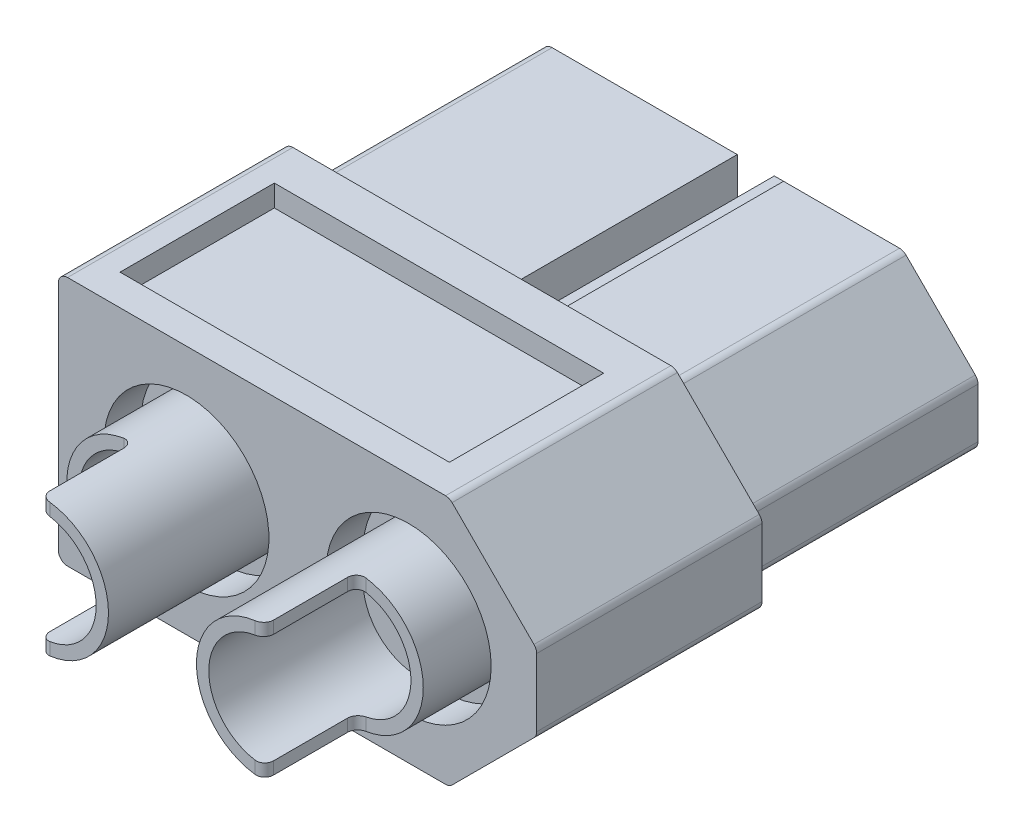
from build123d import *

# Parameters (mm, degrees)
EXTRUDE_1_DEPTH                  = 15
CUT_EXTRUDE_1_DEPTH              = 7.7
SKETCH_13_R                      = 2.175
CUT_EXTRUDE_9_DEPTH              = 7.7
CUT_EXTRUDE_10_REACH             = 18.085
SKETCH_3_W                       = 1.5
SKETCH_3_H                       = 1.2
CUT_EXTRUDE_10_DIRECTION_2_REACH = 18.085
SKETCH_14_W                      = 1.5
SKETCH_14_H                      = 4
EXTRUDE_5_DEPTH                  = 1.2
EXTRUDE_3_DEPTH                  = 6.5
EXTRUDE_3_DEPTH_BACK             = 12
SKETCH_5_R                       = 2.175
CUT_EXTRUDE_START                = -1.2
SKETCH_6_R                       = 2.675
SKETCH_6_R_2                     = 2.175
CUT_EXTRUDE_3_DEPTH              = 1.2
SKETCH_7_R                       = 1.775
CUT_EXTRUDE_4_DEPTH              = 5
CUT_EXTRUDE_5_DEPTH              = 22.553537993
CUT_EXTRUDE_5_DEPTH_BACK         = 22.553537993
SKETCH_8_W                       = 2.15
SKETCH_8_H                       = 3
SKETCH_10_R                      = 2.15
CUT_EXTRUDE_7_DEPTH              = 6.5
FILLET_2_R                       = 0.3
SKETCH_11_W                      = 10.671572875
SKETCH_11_H                      = 5
CUT_EXTRUDE_8_DEPTH              = 0.7
SKETCH_12_W                      = 0.743589744
SKETCH_12_H                      = 0.230769231
EXTRUDE_4_DEPTH                  = 0.2
FILLET_3_R                       = 0.3


with BuildPart() as part:
    # Эскиз1 → Бобышка-Вытянуть1 (new body)
    with BuildSketch(Plane.XY):
        Polygon((7.75, 1.221572875), (4.921572875, 4.05), (-7.75, 4.05), (-7.75, -4.05), (4.921572875, -4.05), (7.75, -1.221572875), align=None)
    extrude(amount=EXTRUDE_1_DEPTH)

    # Эскиз2 → Вырез-Вытянуть1 (cut)
    with BuildSketch(Plane(origin=(0, 0, 0), x_dir=(-1, 0, 0), z_dir=(0, 0, -1))):
        Polygon((-7.75, -1.221572875), (-4.921572875, -4.05), (7.75, -4.05), (7.75, 4.05), (-4.921572875, 4.05), (-7.75, 1.221572875), align=None)
        Polygon((-7.05, -0.931623382), (-4.631623382, -3.35), (7.05, -3.35), (7.05, 3.35), (-4.631623382, 3.35), (-7.05, 0.931623382), align=None, mode=Mode.SUBTRACT)
    extrude(amount=-CUT_EXTRUDE_1_DEPTH, mode=Mode.SUBTRACT)

    # Эскиз13 → Вырез-Вытянуть9 (cut)
    with BuildSketch(Plane(origin=(0, 0, 0), x_dir=(-1, 0, 0), z_dir=(0, 0, -1))):
        with Locations((-3.6, 0)):
            Circle(SKETCH_13_R)
        with Locations((3.6, 0)):
            Circle(SKETCH_13_R)
    extrude(amount=-CUT_EXTRUDE_9_DEPTH, mode=Mode.SUBTRACT)

    # Вырез-Вытянуть10: up to this face of the body (flat: up to its plane)
    cut_extrude_10_end = Plane(part.part.faces().sort_by_distance((3.6, 0, 7.7))[0])
    # Эскиз3 → Вырез-Вытянуть10 (cut, up to the picked face)
    with BuildSketch(Plane(origin=(0, 0, 1.5), x_dir=(-1, 0, 0), z_dir=(0, 0, -1)), mode=Mode.PRIVATE) as cut_extrude_10_sk1:
        with Locations((0, 2.75)):
            Rectangle(SKETCH_3_W, SKETCH_3_H)
    cut_extrude_10_tool1 = split(extrude(cut_extrude_10_sk1.sketch, amount=-CUT_EXTRUDE_10_REACH, mode=Mode.PRIVATE), bisect_by=cut_extrude_10_end, keep=Keep.BOTH, mode=Mode.PRIVATE)
    add(cut_extrude_10_tool1.solids().sort_by(Axis((0, 2.75, 1.5), (0, 0, 1)))[0], mode=Mode.SUBTRACT)

    # Вырез-Вытянуть10 direction 2: up to this face of the body (flat: up to its plane)
    cut_extrude_10_direction_2_end = Plane(part.part.faces().sort_by_distance((-0.620013342, 0, 0))[0])
    # Эскиз3 → Вырез-Вытянуть10 direction 2 (cut, up to the picked face)
    with BuildSketch(Plane(origin=(0, 0, 1.5), x_dir=(-1, 0, 0), z_dir=(0, 0, -1)), mode=Mode.PRIVATE) as cut_extrude_10_direction_2_sk1:
        with Locations((0, 2.75)):
            Rectangle(SKETCH_3_W, SKETCH_3_H)
    cut_extrude_10_direction_2_tool1 = split(extrude(cut_extrude_10_direction_2_sk1.sketch, amount=CUT_EXTRUDE_10_DIRECTION_2_REACH, mode=Mode.PRIVATE), bisect_by=cut_extrude_10_direction_2_end, keep=Keep.BOTH, mode=Mode.PRIVATE)
    add(cut_extrude_10_direction_2_tool1.solids().sort_by(Axis((0, 2.75, 1.5), (0, 0, -1)))[0], mode=Mode.SUBTRACT)

    # Эскиз14 → Бобышка-Вытянуть5 (add)
    with BuildSketch(Plane(origin=(0, 0, 0), x_dir=(-1, 0, 0), z_dir=(0, 0, -1))):
        with Locations((0, 0.15)):
            Rectangle(SKETCH_14_W, SKETCH_14_H)
    extrude(amount=EXTRUDE_5_DEPTH)

    # Эскиз5 → Бобышка-Вытянуть3 (add, two sides: drawn at the far end of the back side and taken through both)
    with BuildSketch(Plane(origin=(0, 0, 7.7), x_dir=(-1, 0, 0), z_dir=(0, 0, -1)).offset(-EXTRUDE_3_DEPTH_BACK)):
        with Locations((3.6, 0)):
            Circle(SKETCH_5_R)
        with Locations((-3.6, 0)):
            Circle(SKETCH_5_R)
    extrude(amount=EXTRUDE_3_DEPTH + EXTRUDE_3_DEPTH_BACK)

    # Эскиз6 → Вырез-Вытянуть3 (cut)
    # profile 1 of 2: a face of its own
    with BuildSketch(Plane.XY.offset(15).offset(CUT_EXTRUDE_START)):
        with Locations((3.6, 0)):
            Circle(SKETCH_6_R)
        with Locations(Location((3.6, 0, 0), (0, 0, 180))):
            Circle(SKETCH_6_R_2, mode=Mode.SUBTRACT)
    # profile 2 of 2: a face of its own
    with BuildSketch(Plane.XY.offset(15).offset(CUT_EXTRUDE_START)):
        with Locations(Location((-3.6, 0, 0), (0, 0, 180))):
            Circle(SKETCH_6_R)
        with Locations(Location((-3.6, 0, 0), (0, 0, 180))):
            Circle(SKETCH_6_R_2, mode=Mode.SUBTRACT)
    extrude(amount=CUT_EXTRUDE_3_DEPTH, mode=Mode.SUBTRACT)

    # Эскиз7 → Вырез-Вытянуть4 (cut)
    with BuildSketch(Plane.XY.offset(19.7)):
        with Locations((-3.6, 0)):
            Circle(SKETCH_7_R)
        with Locations(Location((3.6, 0, 0), (0, 0, 180))):
            Circle(SKETCH_7_R)
    extrude(amount=-CUT_EXTRUDE_4_DEPTH, mode=Mode.SUBTRACT)

    # Эскиз8 → Вырез-Вытянуть5 (cut, two sides: drawn at the far end of the back side and taken through both)
    with BuildSketch(Plane(origin=(0, 0, 0), x_dir=(1, 0, 0), z_dir=(0, 1, 0)).offset(-CUT_EXTRUDE_5_DEPTH_BACK)):
        with Locations((4.7, -18.2)):
            Rectangle(SKETCH_8_W, SKETCH_8_H)
        with Locations((-4.7, -18.2)):
            Rectangle(SKETCH_8_W, SKETCH_8_H)
    extrude(amount=CUT_EXTRUDE_5_DEPTH + CUT_EXTRUDE_5_DEPTH_BACK, mode=Mode.SUBTRACT)

    # Эскиз10 → Вырез-Вытянуть7 (cut)
    with BuildSketch(Plane(origin=(0, 0, 1.2), x_dir=(-1, 0, 0), z_dir=(0, 0, -1))):
        with Locations((-3.6, 0)):
            Circle(SKETCH_10_R)
        with Locations((3.6, 0)):
            Circle(SKETCH_10_R)
    extrude(amount=-CUT_EXTRUDE_7_DEPTH, mode=Mode.SUBTRACT)

    # Скругление2
    fillet_2_edges = [part.edges().sort_by_distance(p)[0] for p in [
        (-3.625, 1.974840126, 16.7),
        (-3.625, -1.974840126, 16.7),
        (-3.625, 1.974840126, 19.7),
        (-3.625, -1.974840126, 19.7),
        (3.625, -1.974840126, 19.7),
        (3.625, 1.974840126, 19.7),
        (3.625, 1.974840126, 16.7),
        (3.625, -1.974840126, 16.7),
    ]]
    fillet(fillet_2_edges, radius=FILLET_2_R)

    # Эскиз11 → Вырез-Вытянуть8 (cut)
    with BuildSketch(Plane(origin=(0, 4.05, 0), x_dir=(1, 0, 0), z_dir=(0, 1, 0))):
        with Locations((-1.414213562, -11.5)):
            Rectangle(SKETCH_11_W, SKETCH_11_H)
    cut_extrude_8 = extrude(amount=-CUT_EXTRUDE_8_DEPTH, mode=Mode.SUBTRACT)

    # Зеркальное отражение1: Вырез-Вытянуть8 across plane
    add(cut_extrude_8.mirror(Plane.ZX), mode=Mode.SUBTRACT)

    # Эскиз12 → Бобышка-Вытянуть4 (add)
    # profile 1 of 5: a face of its own
    with BuildSketch(Plane.XZ.offset(3.35)):
        with BuildLine():
            Line((2.409553644, 12.5), (1.670370952, 11.423878205))
            Line((1.670370952, 11.423878205), (2.306989542, 10.5))
            Line((2.306989542, 10.5), (1.967245952, 10.5))
            Line((1.967245952, 10.5), (1.618287619, 11.006410256))
            add(Edge.make_bspline(
                [(1.618287619, 11.006410256), (1.609716279, 11.019080657), (1.593631875, 11.042857083), (1.57132612, 11.076612212), (1.552930289, 11.106570753), (1.538116623, 11.132498509), (1.52669851, 11.154212753), (1.518724987, 11.171824354), (1.514563909, 11.185833759), (1.514533668, 11.193896175), (1.514521593, 11.197115385)],
                knots=[0, 0, 0, 0, 1.676374632, 3.145772549, 4.433387901, 5.527971266, 6.418173079, 7.119576872, 7.648459376, 8, 8, 8, 8], degree=3))
            add(Edge.make_bspline(
                [(1.514521593, 11.197115385), (1.505939018, 11.184719792), (1.487172134, 11.157615267), (1.45748844, 11.112979609), (1.42192354, 11.062359172), (1.397091731, 11.026070545), (1.383912619, 11.006810897)],
                knots=[0, 0, 0, 0, 0.783829651, 1.713942406, 2.786709065, 4, 4, 4, 4], degree=3))
            Line((1.383912619, 11.006810897), (1.036156209, 10.5))
            Line((1.036156209, 10.5), (0.691604927, 10.5))
            Line((0.691604927, 10.5), (1.328223516, 11.427083333))
            Line((1.328223516, 11.427083333), (0.589040824, 12.5))
            Line((0.589040824, 12.5), (0.929185055, 12.5))
            Line((0.929185055, 12.5), (1.415963901, 11.793269231))
            add(Edge.make_bspline(
                [(1.415963901, 11.793269231), (1.429874296, 11.773252023), (1.457377052, 11.733675264), (1.484627598, 11.693924429), (1.498095311, 11.674278846)],
                knots=[0, 0, 0, 0, 1.011563749, 2, 2, 2, 2], degree=3))
            add(Edge.make_bspline(
                [(1.498095311, 11.674278846), (1.508350537, 11.689255237), (1.527228888, 11.716824555), (1.55350676, 11.754365325), (1.574243279, 11.785462974), (1.58675493, 11.803696514), (1.592245952, 11.811698718)],
                knots=[0, 0, 0, 0, 1.307556106, 2.407017115, 3.300883259, 4, 4, 4, 4], degree=3))
            Line((1.592245952, 11.811698718), (2.065403003, 12.5))
            Line((2.065403003, 12.5), (2.409553644, 12.5))
        make_face()
    # profile 2 of 5: a face of its own
    with BuildSketch(Plane.XZ.offset(3.35)):
        Polygon((-0.142529689, 12.5), (-0.142529689, 10.730769231), (0.498495952, 10.730769231), (0.498495952, 10.5), (-1.065606612, 10.5), (-1.065606612, 10.730769231), (-0.424580971, 10.730769231), (-0.424580971, 12.5), align=None)
    # profile 3 of 5: a face of its own
    with BuildSketch(Plane.XZ.offset(3.35)):
        with Locations((-1.565606612, 11.794871795)):
            Rectangle(SKETCH_12_W, SKETCH_12_H)
    # profile 4 of 5: a face of its own
    with BuildSketch(Plane.XZ.offset(3.35)):
        with BuildLine():
            Line((-3.424580971, 11.012820513), (-3.168170714, 11.038461538))
            add(Edge.make_bspline(
                [(-3.168170714, 11.038461538), (-3.162637587, 11.016408888), (-3.152222327, 10.974898169), (-3.130381624, 10.91859514), (-3.106313636, 10.870972353), (-3.085403784, 10.845328798), (-3.075622638, 10.833333333)],
                knots=[0, 0, 0, 0, 1.199207122, 2.257322842, 3.184815751, 4, 4, 4, 4], degree=3))
            add(Edge.make_bspline(
                [(-3.075622638, 10.833333333), (-3.067226661, 10.825151768), (-3.050713717, 10.809060522), (-3.023605475, 10.788085468), (-2.9950289, 10.770314351), (-2.964897623, 10.755917051), (-2.933374427, 10.744544011), (-2.900328735, 10.736587964), (-2.865835411, 10.731662719), (-2.842332519, 10.731069596), (-2.83043033, 10.730769231)],
                knots=[0, 0, 0, 0, 1.028360939, 2.022547923, 3.001693811, 3.976902288, 4.948369586, 5.937776631, 6.955661634, 8, 8, 8, 8], degree=3))
            add(Edge.make_bspline(
                [(-2.83043033, 10.730769231), (-2.811134834, 10.731390522), (-2.773007776, 10.732618166), (-2.717068568, 10.744636707), (-2.662735872, 10.762624371), (-2.629074759, 10.780858577), (-2.612080971, 10.790064103)],
                knots=[0, 0, 0, 0, 1.010336883, 1.996381556, 2.988474728, 4, 4, 4, 4], degree=3))
            add(Edge.make_bspline(
                [(-2.612080971, 10.790064103), (-2.59537236, 10.803912925), (-2.56107358, 10.832341244), (-2.516363185, 10.88468468), (-2.476649304, 10.945809013), (-2.446911914, 11.002745022), (-2.426541131, 11.054257959), (-2.412351814, 11.098054129), (-2.401070683, 11.146626062), (-2.391441398, 11.199575079), (-2.384061741, 11.257099567), (-2.377872313, 11.319201225), (-2.374453831, 11.386047922), (-2.373691836, 11.432154801), (-2.37329892, 11.455929487)],
                knots=[0, 0, 0, 0, 1.063396562, 2.182898711, 3.360648584, 4.635554171, 5.326740425, 6.076945788, 6.892323083, 7.771510239, 8.716835194, 9.737306867, 10.833258317, 12, 12, 12, 12], degree=3))
            add(Edge.make_bspline(
                [(-2.37329892, 11.455929487), (-2.388420961, 11.43469649), (-2.418023281, 11.393131602), (-2.470229671, 11.338585363), (-2.52758291, 11.292872348), (-2.589479701, 11.256067808), (-2.654415686, 11.227532663), (-2.721371139, 11.207718738), (-2.789707267, 11.194410277), (-2.835976791, 11.193011877), (-2.859276484, 11.192307692)],
                knots=[0, 0, 0, 0, 1.08413448, 2.122259381, 3.131196715, 4.128532876, 5.111902129, 6.075762527, 7.031022177, 8, 8, 8, 8], degree=3))
            add(Edge.make_bspline(
                [(-2.859276484, 11.192307692), (-2.879335113, 11.192845725), (-2.91896475, 11.193908711), (-2.977312599, 11.202381502), (-3.033173293, 11.217040687), (-3.087066674, 11.236596477), (-3.138280419, 11.262548345), (-3.187680871, 11.293421129), (-3.234181975, 11.330776705), (-3.278361884, 11.372807852), (-3.318791772, 11.41951955), (-3.354011769, 11.470048104), (-3.384084754, 11.523760209), (-3.407994953, 11.580986561), (-3.426942067, 11.641468391), (-3.440466388, 11.705170597), (-3.448607312, 11.772225119), (-3.449675511, 11.817952311), (-3.450221997, 11.841346154)],
                knots=[0, 0, 0, 0, 0.98160025, 1.939337942, 2.877944864, 3.804478064, 4.739961265, 5.683019169, 6.650831814, 7.654132266, 8.664499124, 9.669140276, 10.664058004, 11.671756914, 12.699296594, 13.762159139, 14.855129872, 16, 16, 16, 16], degree=3))
            add(Edge.make_bspline(
                [(-3.450221997, 11.841346154), (-3.449205427, 11.872255519), (-3.447194921, 11.933386097), (-3.431638092, 12.023309385), (-3.405678589, 12.109657753), (-3.376234965, 12.178595328), (-3.347397901, 12.230599027), (-3.324243576, 12.267706456), (-3.298763247, 12.302235538), (-3.271791207, 12.334809164), (-3.24215088, 12.364348465), (-3.21154256, 12.392310663), (-3.178266318, 12.417064942), (-3.143670898, 12.440019531), (-3.107048998, 12.459876988), (-3.069422525, 12.477656034), (-3.030442368, 12.492515667), (-2.990212902, 12.504432747), (-2.948914587, 12.514189149), (-2.906331794, 12.520915132), (-2.86256527, 12.525058779), (-2.832977051, 12.525445441), (-2.818010458, 12.525641026)],
                knots=[0, 0, 0, 0, 1.777706882, 3.515835744, 5.23207167, 6.95628682, 7.816020017, 8.65165611, 9.4707737, 10.283378767, 11.082060806, 11.8764812, 12.666355411, 13.46551777, 14.263312302, 15.060773764, 15.858457287, 16.660642738, 17.473247806, 18.298111139, 19.139134514, 20, 20, 20, 20], degree=3))
            add(Edge.make_bspline(
                [(-2.818010458, 12.525641026), (-2.792735334, 12.524938361), (-2.743166371, 12.523560313), (-2.670602852, 12.513024679), (-2.601625446, 12.495255436), (-2.536114005, 12.470889101), (-2.474210085, 12.439399352), (-2.416128389, 12.400504218), (-2.361618956, 12.354685003), (-2.310604758, 12.301918347), (-2.264520387, 12.24080908), (-2.224345295, 12.170788215), (-2.191437737, 12.091274476), (-2.163643309, 12.003260159), (-2.143064917, 11.905912626), (-2.127194496, 11.799860676), (-2.118847099, 11.684695575), (-2.117556794, 11.604979563), (-2.116888663, 11.563701923)],
                knots=[0, 0, 0, 0, 0.898449204, 1.762016875, 2.600428026, 3.426826527, 4.242280324, 5.064055083, 5.906691075, 6.769749479, 7.668135943, 8.621070442, 9.631748766, 10.722023185, 11.898351526, 13.165512303, 14.532277789, 16, 16, 16, 16], degree=3))
            add(Edge.make_bspline(
                [(-2.116888663, 11.563701923), (-2.117049841, 11.540196231), (-2.117367705, 11.493840044), (-2.119657083, 11.425557414), (-2.124171207, 11.359705733), (-2.130104644, 11.296370871), (-2.137749588, 11.23545144), (-2.146723511, 11.176986922), (-2.15817292, 11.121059142), (-2.170770587, 11.067544552), (-2.18538483, 11.016406407), (-2.201089624, 10.967580201), (-2.219316507, 10.921423671), (-2.238879294, 10.877657175), (-2.260166926, 10.836344837), (-2.282829754, 10.797327861), (-2.307881587, 10.761106742), (-2.325898454, 10.738419539), (-2.334837381, 10.727163462)],
                knots=[0, 0, 0, 0, 1.280444348, 2.525197649, 3.720942618, 4.875526429, 5.989898656, 7.065115415, 8.096622082, 9.098853712, 10.059152529, 10.993162051, 11.891531392, 12.760921141, 13.603603485, 14.422073071, 15.217123906, 16, 16, 16, 16], degree=3))
            add(Edge.make_bspline(
                [(-2.334837381, 10.727163462), (-2.350989046, 10.70899602), (-2.382825478, 10.673186305), (-2.437287603, 10.626928637), (-2.495321585, 10.587417471), (-2.557852996, 10.555495869), (-2.624403905, 10.530608764), (-2.695016033, 10.512542931), (-2.76988642, 10.502065995), (-2.821048955, 10.500699827), (-2.847257253, 10.5)],
                knots=[0, 0, 0, 0, 1.005002357, 1.980952959, 2.948226316, 3.90482984, 4.879026092, 5.883055346, 6.915583142, 8, 8, 8, 8], degree=3))
            add(Edge.make_bspline(
                [(-2.847257253, 10.5), (-2.86677224, 10.500344965), (-2.905111005, 10.501022676), (-2.96128708, 10.507525381), (-3.0147204, 10.518393677), (-3.065529973, 10.533053793), (-3.113420355, 10.55256828), (-3.158943666, 10.57569506), (-3.201637653, 10.603515122), (-3.241193233, 10.635648383), (-3.277708384, 10.671183953), (-3.310414496, 10.710420241), (-3.339188337, 10.752868229), (-3.364254919, 10.798616198), (-3.385390251, 10.847447594), (-3.40274341, 10.899572287), (-3.415932968, 10.954976883), (-3.421658345, 10.993272039), (-3.424580971, 11.012820513)],
                knots=[0, 0, 0, 0, 1.095988384, 2.15315746, 3.171326302, 4.156539379, 5.119213808, 6.072133135, 7.021027441, 7.975952916, 8.930907862, 9.879001051, 10.840359051, 11.807350428, 12.805278655, 13.825435679, 14.889953203, 16, 16, 16, 16], degree=3))
        make_face()
        with BuildLine():
            add(Edge.make_bspline(
                [(-2.37329892, 11.836137821), (-2.374016018, 11.856213389), (-2.375440802, 11.896100972), (-2.386198612, 11.955203172), (-2.404061977, 12.012786088), (-2.428196125, 12.068390574), (-2.458310035, 12.120150218), (-2.493638173, 12.166310329), (-2.534083597, 12.205660233), (-2.579378434, 12.238011519), (-2.628921456, 12.263145841), (-2.682004972, 12.282004486), (-2.739041753, 12.292884687), (-2.778301196, 12.294199421), (-2.798379048, 12.294871795)],
                knots=[0, 0, 0, 0, 1.034371533, 2.055163721, 3.085036369, 4.136219926, 5.172765015, 6.164074703, 7.123048089, 8.070464312, 9.021723619, 9.977430468, 10.965628467, 12, 12, 12, 12], degree=3))
            add(Edge.make_bspline(
                [(-2.798379048, 12.294871795), (-2.812690159, 12.294486512), (-2.840624182, 12.293734474), (-2.881512736, 12.287856191), (-2.920445828, 12.278971799), (-2.957240692, 12.265374111), (-2.992153593, 12.248728978), (-3.025010708, 12.227923664), (-3.055820971, 12.203541393), (-3.084251981, 12.175428661), (-3.109950844, 12.144170883), (-3.132278854, 12.109949786), (-3.151996819, 12.07333114), (-3.166827816, 12.033414304), (-3.17891295, 11.991222112), (-3.187797826, 11.946355567), (-3.193014184, 11.89876317), (-3.193542038, 11.866065532), (-3.19381174, 11.849358974)],
                knots=[0, 0, 0, 0, 1.023462019, 1.997707343, 2.950204755, 3.875082018, 4.798131411, 5.712685617, 6.65128003, 7.603921197, 8.567945975, 9.540503156, 10.523517238, 11.53671457, 12.580096959, 13.661292135, 14.805058716, 16, 16, 16, 16], degree=3))
            add(Edge.make_bspline(
                [(-3.19381174, 11.849358974), (-3.193561894, 11.833315809), (-3.193073288, 11.801941374), (-3.187564715, 11.756161109), (-3.179560946, 11.712876171), (-3.167163442, 11.672361028), (-3.152247701, 11.634380147), (-3.133566861, 11.599044367), (-3.111406427, 11.566386561), (-3.085814449, 11.536495797), (-3.05750731, 11.509542871), (-3.026154579, 11.486496695), (-2.992561433, 11.466927595), (-2.95649212, 11.450661568), (-2.917896572, 11.438290921), (-2.87679645, 11.429702383), (-2.833409855, 11.423711558), (-2.803608807, 11.423291711), (-2.788363022, 11.423076923)],
                knots=[0, 0, 0, 0, 1.155242457, 2.259222408, 3.317825484, 4.322358011, 5.306829979, 6.253722241, 7.195762508, 8.144412979, 9.083697585, 10.00547228, 10.941152501, 11.87999348, 12.850638972, 13.854618393, 14.902453872, 16, 16, 16, 16], degree=3))
            add(Edge.make_bspline(
                [(-2.788363022, 11.423076923), (-2.774184247, 11.423298248), (-2.746243624, 11.423734389), (-2.705270727, 11.42977617), (-2.665772448, 11.438366622), (-2.627947455, 11.450919976), (-2.591737693, 11.466841249), (-2.557566667, 11.486935563), (-2.524376069, 11.509510899), (-2.493912735, 11.53655677), (-2.465362075, 11.565737548), (-2.440941046, 11.598093723), (-2.419976401, 11.63229562), (-2.402520201, 11.668583243), (-2.38925884, 11.70731939), (-2.38025744, 11.748333398), (-2.374451693, 11.791502067), (-2.373689156, 11.821027749), (-2.37329892, 11.836137821)],
                knots=[0, 0, 0, 0, 1.03701548, 2.04353757, 3.025450354, 3.993097303, 4.955942005, 5.915106969, 6.891406964, 7.889250744, 8.89182446, 9.875341956, 10.849485896, 11.824610452, 12.817027865, 13.839237692, 14.894207727, 16, 16, 16, 16], degree=3))
        make_face(mode=Mode.SUBTRACT)
    # profile 5 of 5: a face of its own
    with BuildSketch(Plane.XZ.offset(3.35)):
        with BuildLine():
            add(Edge.make_bspline(
                [(-3.706632253, 11.513621795), (-3.706890656, 11.485039973), (-3.70739676, 11.429060219), (-3.710534126, 11.347151553), (-3.716016862, 11.269367139), (-3.724184061, 11.195770668), (-3.73392896, 11.126079417), (-3.746412589, 11.06047911), (-3.760658444, 10.998896055), (-3.777544534, 10.94156398), (-3.796410046, 10.887888035), (-3.817455203, 10.837717161), (-3.841420529, 10.791307626), (-3.866282669, 10.747554607), (-3.894569606, 10.708136888), (-3.924294567, 10.671622779), (-3.956362694, 10.638646505), (-3.990911519, 10.609367576), (-4.027673214, 10.583518907), (-4.066532033, 10.561084992), (-4.107768103, 10.541976676), (-4.151497732, 10.527006592), (-4.197295279, 10.514957676), (-4.24534197, 10.506050662), (-4.295723462, 10.500810114), (-4.330150848, 10.500273089), (-4.347657894, 10.5)],
                knots=[0, 0, 0, 0, 1.514548985, 2.966363668, 4.342801279, 5.645536807, 6.88951609, 8.070636169, 9.18292944, 10.237633186, 11.23586543, 12.196673567, 13.117642805, 14.002448775, 14.860474521, 15.685016546, 16.495716207, 17.293997176, 18.081286888, 18.873901753, 19.668661895, 20.485546082, 21.319749152, 22.176139114, 23.072528574, 24, 24, 24, 24], degree=3))
            add(Edge.make_bspline(
                [(-4.347657894, 10.5), (-4.373346462, 10.500743326), (-4.423812684, 10.502203621), (-4.497400266, 10.51446378), (-4.566965807, 10.53453621), (-4.631981814, 10.562470303), (-4.691591996, 10.598255154), (-4.745050089, 10.641255911), (-4.791064941, 10.692113515), (-4.830545767, 10.749788852), (-4.864430478, 10.814264364), (-4.89473289, 10.884987116), (-4.92190442, 10.962241245), (-4.941792159, 11.031199548), (-4.955735368, 11.09082742), (-4.964224366, 11.140099821), (-4.972062177, 11.19310179), (-4.977617723, 11.249960266), (-4.983270943, 11.3104095), (-4.986062006, 11.37471308), (-4.988192, 11.44282734), (-4.988516618, 11.489581254), (-4.988683535, 11.513621795)],
                knots=[0, 0, 0, 0, 1.134392726, 2.228560011, 3.285421824, 4.326686528, 5.345663051, 6.348245061, 7.346442277, 8.364444627, 9.428234171, 10.559369172, 11.76117748, 13.044149777, 13.72830454, 14.465558531, 15.252424724, 16.094928615, 16.989169351, 17.934396366, 18.93788079, 20, 20, 20, 20], degree=3))
            add(Edge.make_bspline(
                [(-4.988683535, 11.513621795), (-4.988421798, 11.542069597), (-4.987910444, 11.59764798), (-4.984836252, 11.678896633), (-4.979096984, 11.756105619), (-4.97170601, 11.829370433), (-4.961737764, 11.898754369), (-4.949361176, 11.963975928), (-4.934879576, 12.025190667), (-4.918595562, 12.082644495), (-4.899809539, 12.136463947), (-4.878522974, 12.186580591), (-4.855284658, 12.233382515), (-4.829697881, 12.276632219), (-4.801894822, 12.316472572), (-4.772324524, 12.353168674), (-4.740164834, 12.386210404), (-4.705480837, 12.415430087), (-4.668969528, 12.441755587), (-4.629897576, 12.464275364), (-4.588355717, 12.483062434), (-4.54471437, 12.498764476), (-4.498683817, 12.5106977), (-4.450503913, 12.519557801), (-4.399860324, 12.524849837), (-4.365298783, 12.525373657), (-4.347657894, 12.525641026)],
                knots=[0, 0, 0, 0, 1.508950488, 2.948031798, 4.311688408, 5.614950163, 6.853137481, 8.028455569, 9.134944892, 10.188708076, 11.194600246, 12.156350049, 13.075032267, 13.964295672, 14.819092354, 15.649926205, 16.461420415, 17.260483761, 18.05264124, 18.846032929, 19.648010917, 20.468054852, 21.303075505, 22.167271292, 23.064539283, 24, 24, 24, 24], degree=3))
            add(Edge.make_bspline(
                [(-4.347657894, 12.525641026), (-4.324529162, 12.524981277), (-4.2794345, 12.52369495), (-4.213577072, 12.514955146), (-4.151766362, 12.499572681), (-4.093481034, 12.478942626), (-4.03937623, 12.45134874), (-3.989193621, 12.417775389), (-3.941924824, 12.379003694), (-3.914714031, 12.348413716), (-3.90094315, 12.332932692)],
                knots=[0, 0, 0, 0, 1.10322584, 2.150986741, 3.161425019, 4.136713905, 5.093944212, 6.049774532, 7.013026876, 8, 8, 8, 8], degree=3))
            add(Edge.make_bspline(
                [(-3.90094315, 12.332932692), (-3.88509255, 12.310067969), (-3.852407934, 12.262919931), (-3.814153426, 12.182528153), (-3.780029726, 12.094028093), (-3.753248879, 11.995683389), (-3.732272799, 11.888276756), (-3.717122833, 11.771597437), (-3.708549443, 11.645695842), (-3.707285743, 11.558640309), (-3.706632253, 11.513621795)],
                knots=[0, 0, 0, 0, 0.779365345, 1.607084704, 2.489375761, 3.438383567, 4.461919411, 5.557722155, 6.737039282, 8, 8, 8, 8], degree=3))
        make_face()
        with BuildLine():
            add(Edge.make_bspline(
                [(-3.963042509, 11.512820513), (-3.963297104, 11.551287787), (-3.963784455, 11.624922659), (-3.968876092, 11.730122778), (-3.977641134, 11.825027645), (-3.989229093, 11.909505858), (-4.00452989, 11.983671691), (-4.023741851, 12.047336146), (-4.0453983, 12.101263342), (-4.072197745, 12.144784892), (-4.101540177, 12.180261303), (-4.131834233, 12.210772165), (-4.163792628, 12.236705698), (-4.197206836, 12.258328977), (-4.232595303, 12.274700702), (-4.269571062, 12.286566966), (-4.308142158, 12.293395818), (-4.334410827, 12.294376995), (-4.347657894, 12.294871795)],
                knots=[0, 0, 0, 0, 1.89448813, 3.626469325, 5.185477471, 6.587276848, 7.82441448, 8.910550357, 9.859733512, 10.6775885, 11.416198291, 12.123144072, 12.791880183, 13.439617036, 14.078171869, 14.70637855, 15.347637704, 16, 16, 16, 16], degree=3))
            add(Edge.make_bspline(
                [(-4.347657894, 12.294871795), (-4.360901751, 12.294366314), (-4.387164055, 12.293363956), (-4.425822707, 12.286683786), (-4.46266046, 12.274213761), (-4.497974003, 12.257872984), (-4.531787722, 12.236800502), (-4.563308216, 12.210293699), (-4.593941824, 12.179875468), (-4.622971402, 12.143993849), (-4.649947746, 12.100487759), (-4.671563283, 12.046526313), (-4.690792566, 11.98287364), (-4.706043323, 11.908831162), (-4.717713696, 11.824499242), (-4.726414817, 11.72985358), (-4.731543876, 11.624790051), (-4.73202269, 11.551288056), (-4.732273279, 11.512820513)],
                knots=[0, 0, 0, 0, 0.652578524, 1.294050225, 1.924494109, 2.563260593, 3.207694917, 3.880813851, 4.587993952, 5.331957758, 6.150083828, 7.099581593, 8.186077474, 9.42362516, 10.819375359, 12.378900244, 14.104883934, 16, 16, 16, 16], degree=3))
            add(Edge.make_bspline(
                [(-4.732273279, 11.512820513), (-4.732030466, 11.475153445), (-4.731565245, 11.402984768), (-4.726307295, 11.299811373), (-4.71806781, 11.206499312), (-4.706796897, 11.122963294), (-4.691819761, 11.049291683), (-4.673648778, 10.98533489), (-4.652012972, 10.931206987), (-4.626233752, 10.8864332), (-4.597650583, 10.849473919), (-4.567281698, 10.81810633), (-4.5357148, 10.790617859), (-4.50114597, 10.76909382), (-4.465044782, 10.751441003), (-4.426637342, 10.739623633), (-4.386419571, 10.732039336), (-4.358911446, 10.731198792), (-4.344853407, 10.730769231)],
                knots=[0, 0, 0, 0, 1.850145643, 3.544809038, 5.072983816, 6.450691362, 7.683229814, 8.76276662, 9.712991103, 10.538891656, 11.292051756, 12.001912283, 12.681449089, 13.342071824, 13.996410874, 14.649960216, 15.310061595, 16, 16, 16, 16], degree=3))
            add(Edge.make_bspline(
                [(-4.344853407, 10.730769231), (-4.331605466, 10.731113273), (-4.305482225, 10.731791679), (-4.267263788, 10.738387135), (-4.230879722, 10.749153965), (-4.196572164, 10.764685423), (-4.164001525, 10.783953724), (-4.133128282, 10.807389773), (-4.104692654, 10.835714763), (-4.087579271, 10.856936176), (-4.078827766, 10.867788462)],
                knots=[0, 0, 0, 0, 1.021462953, 2.014194051, 2.982449609, 3.941891643, 4.91211921, 5.897280499, 6.924703483, 8, 8, 8, 8], degree=3))
            add(Edge.make_bspline(
                [(-4.078827766, 10.867788462), (-4.06929736, 10.883721565), (-4.049171148, 10.917368926), (-4.026659476, 10.975851239), (-4.006696107, 11.042801959), (-3.990481911, 11.119046972), (-3.978484133, 11.20448157), (-3.969191921, 11.298969498), (-3.964318276, 11.402860436), (-3.963479498, 11.475155876), (-3.963042509, 11.512820513)],
                knots=[0, 0, 0, 0, 0.671109831, 1.417242661, 2.260125669, 3.199948126, 4.23589883, 5.382398214, 6.636276086, 8, 8, 8, 8], degree=3))
        make_face(mode=Mode.SUBTRACT)
    extrude(amount=EXTRUDE_4_DEPTH)

    # Скругление3
    fillet_3_edges = [part.edges().sort_by_distance(p)[0] for p in [
        (-7.75, -4.05, 11.35),
        (-7.75, 4.05, 11.35),
        (4.921572875, 4.05, 11.35),
        (7.75, 1.221572875, 11.35),
        (7.75, -1.221572875, 11.35),
        (4.921572875, -4.05, 11.35),
        (7.05, -0.931623382, 3.85),
        (4.631623382, -3.35, 3.85),
        (-7.05, -3.35, 3.85),
        (-7.05, 3.35, 3.85),
        (4.631623382, 3.35, 3.85),
        (7.05, 0.931623382, 3.85),
    ]]
    fillet(fillet_3_edges, radius=FILLET_3_R)


solid = part.part
